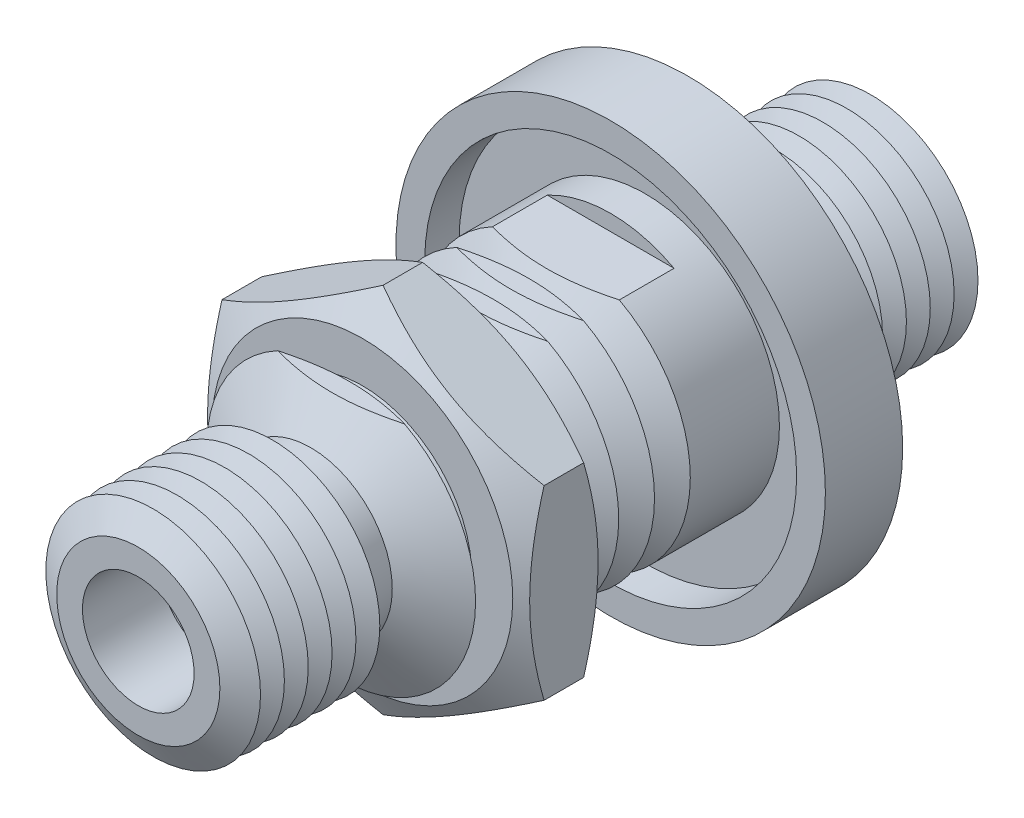
from build123d import *

# Parameters (mm, degrees)
LPATTERN1_COUNT    = 5
LPATTERN1_PITCH    = 0.705555556
LPATTERN2_COUNT    = 5
LPATTERN2_PITCH    = 0.705555556
LPATTERN3_COUNT    = 6
LPATTERN3_PITCH    = 1.058333333
SKETCH5_W          = 14.29528521
SKETCH5_H          = 4.711554676
CUT_EXTRUDE1_DEPTH = 17.607404975
SKETCH7_OUTSIDE_W  = 20.78
SKETCH7_OUTSIDE_H  = 20.78
CUT_EXTRUDE2_DEPTH = 2.54


with BuildPart() as part:
    # Sketch1 → Revolve1 (revolve)
    with BuildSketch(Plane(origin=(0, 0, 0), x_dir=(0, 0, -1), z_dir=(1, 0, 0)), mode=Mode.PRIVATE) as revolve1_sk:
        Polygon((-11.684, 0), (5.842, 0), (5.842, 1.651), (8.128, 1.651), (8.128, 2.413), (7.688059095, 3.175), (4.160281317, 3.175), (3.720340412, 2.413), (2.286, 2.413), (2.286, 6.35), (0, 6.35), (0, 5.4991), (1.016, 5.4991), (1.016, 3.9751), (-7.970281317, 3.9751), (-8.872160173, 2.413), (-9.562340412, 2.413), (-10.002281317, 3.175), (-13.530059095, 3.175), (-13.97, 2.413), (-13.97, 1.651), (-11.684, 1.651), align=None)
    revolve(revolve1_sk.sketch.rotate(Axis((0, 0, -16.242320186), (0, 0, -1)), 90), axis=Axis((0, 0, -16.242320186), (0, 0, -1)))

    # Sketch2 → Cut-Revolve1 (revolve, cut)
    with BuildSketch(Plane(origin=(0, 0, 0), x_dir=(0, 0, -1), z_dir=(1, 0, 0)), mode=Mode.PRIVATE) as cut_revolve1_sk:
        Polygon((7.834706063, 3.429), (7.335281317, 2.563970965), (6.835856571, 3.429), align=None)
    cut_revolve1 = revolve(cut_revolve1_sk.sketch.rotate(Axis((0, 0, 15.0749), (0, 0, -1)), 90), axis=Axis((0, 0, 15.0749), (0, 0, -1)), mode=Mode.SUBTRACT)

    # LPattern1: Cut-Revolve1 ×5
    with Locations(*[(0, 0, i * LPATTERN1_PITCH) for i in range(1, LPATTERN1_COUNT)]):
        add(cut_revolve1, mode=Mode.SUBTRACT)

    # Sketch3 → Cut-Revolve2 (revolve, cut)
    with BuildSketch(Plane(origin=(0, 0, 0), x_dir=(0, 0, -1), z_dir=(1, 0, 0)), mode=Mode.PRIVATE) as cut_revolve2_sk:
        Polygon((-13.177281317, 2.563970965), (-12.677856571, 3.429), (-13.676706063, 3.429), align=None)
    cut_revolve2 = revolve(cut_revolve2_sk.sketch.rotate(Axis((0, 0, 15.0749), (0, 0, -1)), 90), axis=Axis((0, 0, 15.0749), (0, 0, -1)), mode=Mode.SUBTRACT)

    # LPattern2: Cut-Revolve2 ×5
    with Locations(*[(0, 0, -i * LPATTERN2_PITCH) for i in range(1, LPATTERN2_COUNT)]):
        add(cut_revolve2, mode=Mode.SUBTRACT)

    # Sketch4 → Cut-Revolve3 (revolve, cut)
    with BuildSketch(Plane(origin=(0, 0, 0), x_dir=(0, 0, -1), z_dir=(1, 0, 0)), mode=Mode.PRIVATE) as cut_revolve3_sk:
        Polygon((-7.44111465, 3.058556448), (-6.765301015, 4.2291), (-8.116928285, 4.2291), align=None)
    cut_revolve3 = revolve(cut_revolve3_sk.sketch.rotate(Axis((0, 0, 15.0749), (0, 0, -1)), 90), axis=Axis((0, 0, 15.0749), (0, 0, -1)), mode=Mode.SUBTRACT)

    # LPattern3: Cut-Revolve3 ×6
    with Locations(*[(0, 0, -i * LPATTERN3_PITCH) for i in range(1, LPATTERN3_COUNT)]):
        add(cut_revolve3, mode=Mode.SUBTRACT)

    # Sketch5 → Cut-Extrude1 (cut, through all)
    with BuildSketch(Plane.XY):
        with Locations((0, 5.860977338)):
            Rectangle(SKETCH5_W, SKETCH5_H)
    extrude(amount=CUT_EXTRUDE1_DEPTH, mode=Mode.SUBTRACT)

    # Sketch6 → Revolve2 (revolve)
    with BuildSketch(Plane(origin=(0, 0, 0), x_dir=(0, 0, -1), z_dir=(1, 0, 0)), mode=Mode.PRIVATE) as revolve2_sk:
        Polygon((-4.953, 1.294193357), (-4.953, 4.445), (-6.1468, 6.512722254), (-7.3406, 4.445), (-7.3406, 1.294193357), align=None)
    revolve(revolve2_sk.sketch.rotate(Axis((0, 0, 19.844161095), (0, 0, -1)), 331.858944442), axis=Axis((0, 0, 19.844161095), (0, 0, -1)))

    # Sketch7 outside → Cut-Extrude2 (cut)
    with BuildSketch(Plane.XY.offset(7.3406)):
        Rectangle(SKETCH7_OUTSIDE_W, SKETCH7_OUTSIDE_H)
        Polygon((0, 5.499261314), (-4.7625, 2.749630657), (-4.7625, -2.749630657), (0, -5.499261314), (4.7625, -2.749630657), (4.7625, 2.749630657), align=None, mode=Mode.SUBTRACT)
    extrude(amount=-CUT_EXTRUDE2_DEPTH, mode=Mode.SUBTRACT)


solid = part.part
